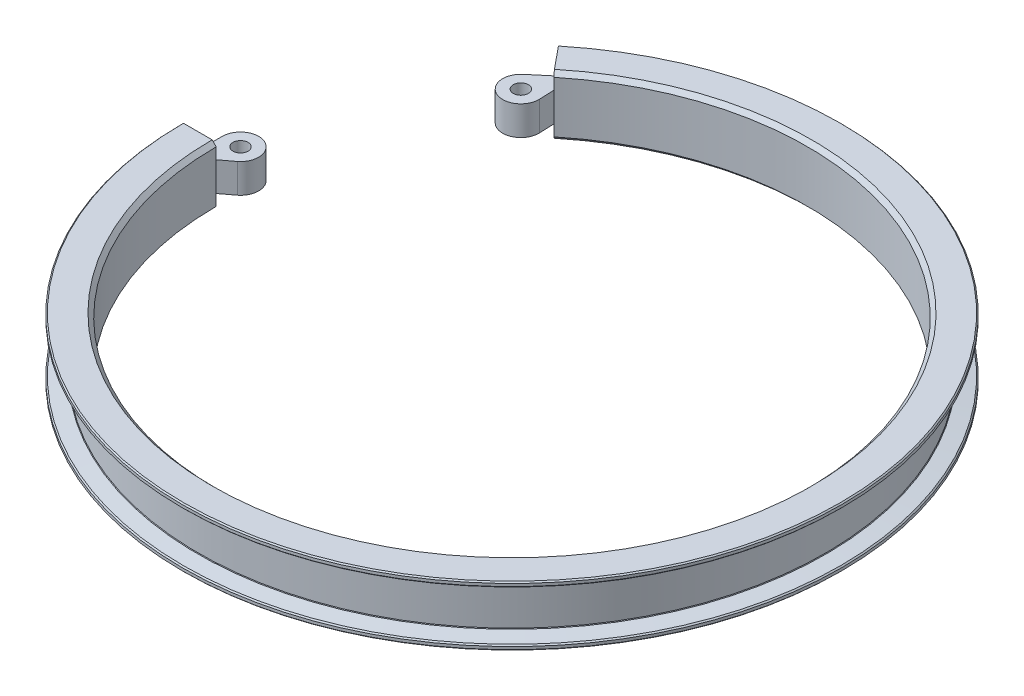
from build123d import *

# Parameters (mm, degrees)
BOSS_EXTRUDE2_DEPTH      = 3.175
BOSS_EXTRUDE2_DEPTH_BACK = 3.175
SKETCH5_R                = 1.651


with BuildPart() as part:
    # Sweep2: sweep along a path in Sketch4
    with BuildLine(Plane(origin=(0, 0, 0), x_dir=(1, 0, 0), z_dir=(0, 1, 0))) as sweep2_path:
        ThreePointArc((-66.167, 0), (59.78583857, -28.350051068), (-41.873155771, 51.231930617))
    # Sketch1 → Sweep2 (sweep)
    with BuildSketch(Plane.XY):
        with BuildLine():
            Line((-68.072, 4.699), (-68.072, -4.699))
            ThreePointArc((-68.072, -4.699), (-68.117948863, -4.772140282), (-68.185476115, -4.826))
            Line((-68.185476115, -4.826), (-71.374, -5.38822279))
            Line((-71.374, -5.38822279), (-71.628, -5.64222279))
            Line((-71.628, -5.64222279), (-71.628, -6.233150289))
            Line((-71.628, -6.233150289), (-71.374, -6.487150289))
            Line((-71.374, -6.487150289), (-65.145686506, -6.487150289))
            Line((-65.145686506, -6.487150289), (-64.262, -5.603463784))
            Line((-64.262, -5.603463784), (-64.262, 5.603463784))
            Line((-64.262, 5.603463784), (-65.145686506, 6.487150289))
            Line((-65.145686506, 6.487150289), (-71.374, 6.487150289))
            Line((-71.374, 6.487150289), (-71.628, 6.233150289))
            Line((-71.628, 6.233150289), (-71.628, 5.64222279))
            Line((-71.628, 5.64222279), (-71.374, 5.38822279))
            Line((-71.374, 5.38822279), (-68.185476115, 4.826))
            ThreePointArc((-68.185476115, 4.826), (-68.117948863, 4.772140282), (-68.072, 4.699))
        make_face()
    sweep(path=sweep2_path.line)

    # Sketch5 → Boss-Extrude2 (add, two sides: drawn at the far end of the back side and taken through both)
    # profile 1 of 2: a face of its own
    with BuildSketch(Plane(origin=(0, 0, 0), x_dir=(1, 0, 0), z_dir=(0, 1, 0)).offset(-BOSS_EXTRUDE2_DEPTH_BACK)):
        with BuildLine():
            Line((-68.072, 0), (-67.997817291, 5.05529393))
            ThreePointArc((-67.997817291, 5.05529393), (-62.347816522, 8.624761173), (-61.63409996, 1.979897461))
            Line((-61.63409996, 1.979897461), (-64.262, 0))
            Line((-64.262, 0), (-68.072, 0))
        make_face()
        with Locations(Location((-64.060894811, 5.08, 0), (0, 0, 270))):
            Circle(SKETCH5_R, mode=Mode.SUBTRACT)
    # profile 2 of 2: a face of its own
    with BuildSketch(Plane(origin=(0, 0, 0), x_dir=(1, 0, 0), z_dir=(0, 1, 0)).offset(-BOSS_EXTRUDE2_DEPTH_BACK)):
        with BuildLine():
            Line((-40.533809509, 46.472492493), (-40.663586841, 49.760198444))
            Line((-40.663586841, 49.760198444), (-43.074471436, 52.710407838))
            Line((-43.074471436, 52.710407838), (-46.942012037, 49.454086372))
            ThreePointArc((-46.942012037, 49.454086372), (-46.130772136, 42.82042261), (-40.533809509, 46.472492493))
        make_face()
        with Locations(Location((-44.469944405, 46.389963231, 0), (0, 0, 90))):
            Circle(SKETCH5_R, mode=Mode.SUBTRACT)
    extrude(amount=BOSS_EXTRUDE2_DEPTH + BOSS_EXTRUDE2_DEPTH_BACK)


solid = part.part
